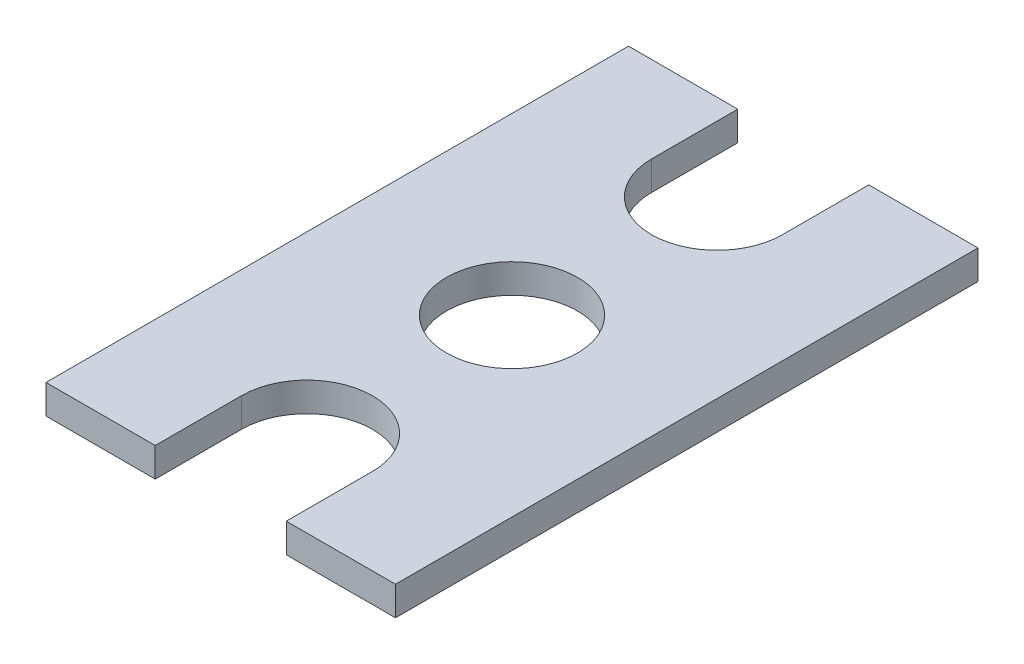
from build123d import *

# Parameters (mm, degrees)
SKETCH1_W          = 19.05
SKETCH1_H          = 31.75
EXTRUDE1_DEPTH     = 1.5875
SKETCH3_R          = 3.571875
CUT_EXTRUDE6_DEPTH = 25.989408261
SKETCH5_R          = 3.571875
CUT_EXTRUDE8_DEPTH = 25.989408261
CIRPATTERN1_COUNT  = 2
SKETCH6_W          = 7.14375
SKETCH6_H          = 4.699
CUT_EXTRUDE9_DEPTH = 25.989408261
CIRPATTERN2_COUNT  = 2


with BuildPart() as part:
    # Sketch1 → Extrude1 (new body)
    with BuildSketch(Plane(origin=(0, 0, 0), x_dir=(1, 0, 0), z_dir=(0, 1, 0))):
        with Locations((3.175, 5.588)):
            Rectangle(SKETCH1_W, SKETCH1_H)
    extrude(amount=EXTRUDE1_DEPTH)

    # Sketch3 → Cut-Extrude6 (cut, through all)
    with BuildSketch(Plane(origin=(0, 0, 0), x_dir=(1, 0, 0), z_dir=(0, 1, 0))):
        with Locations(Location((3.175, 5.588, 0), (0, 0, 270))):
            Circle(SKETCH3_R)
    extrude(amount=CUT_EXTRUDE6_DEPTH, mode=Mode.SUBTRACT)

    # Sketch5 → Cut-Extrude8 (cut, through all)
    with BuildSketch(Plane(origin=(0, 0, 0), x_dir=(1, 0, 0), z_dir=(0, 1, 0))):
        with Locations(Location((3.175, 16.764, 0), (0, 0, 270))):
            Circle(SKETCH5_R)
    cut_extrude8 = extrude(amount=CUT_EXTRUDE8_DEPTH, mode=Mode.SUBTRACT)

    # CirPattern1: Cut-Extrude8 ×2 about axis
    cirpattern1_axis = Axis((3.175, 0, -5.588), (0, 1, 0))
    for i in range(1, CIRPATTERN1_COUNT):
        add(cut_extrude8.rotate(cirpattern1_axis, i * 360 / CIRPATTERN1_COUNT), mode=Mode.SUBTRACT)

    # Sketch6 → Cut-Extrude9 (cut, through all)
    with BuildSketch(Plane(origin=(0, 0, 0), x_dir=(1, 0, 0), z_dir=(0, 1, 0))):
        with Locations((3.175, -7.9375)):
            Rectangle(SKETCH6_W, SKETCH6_H)
    cut_extrude9 = extrude(amount=CUT_EXTRUDE9_DEPTH, mode=Mode.SUBTRACT)

    # CirPattern2: Cut-Extrude9 ×2 about axis
    cirpattern2_axis = Axis((3.175, 1.5875, -5.588), (0, -1, 0))
    for i in range(1, CIRPATTERN2_COUNT):
        add(cut_extrude9.rotate(cirpattern2_axis, i * 360 / CIRPATTERN2_COUNT), mode=Mode.SUBTRACT)


solid = part.part
